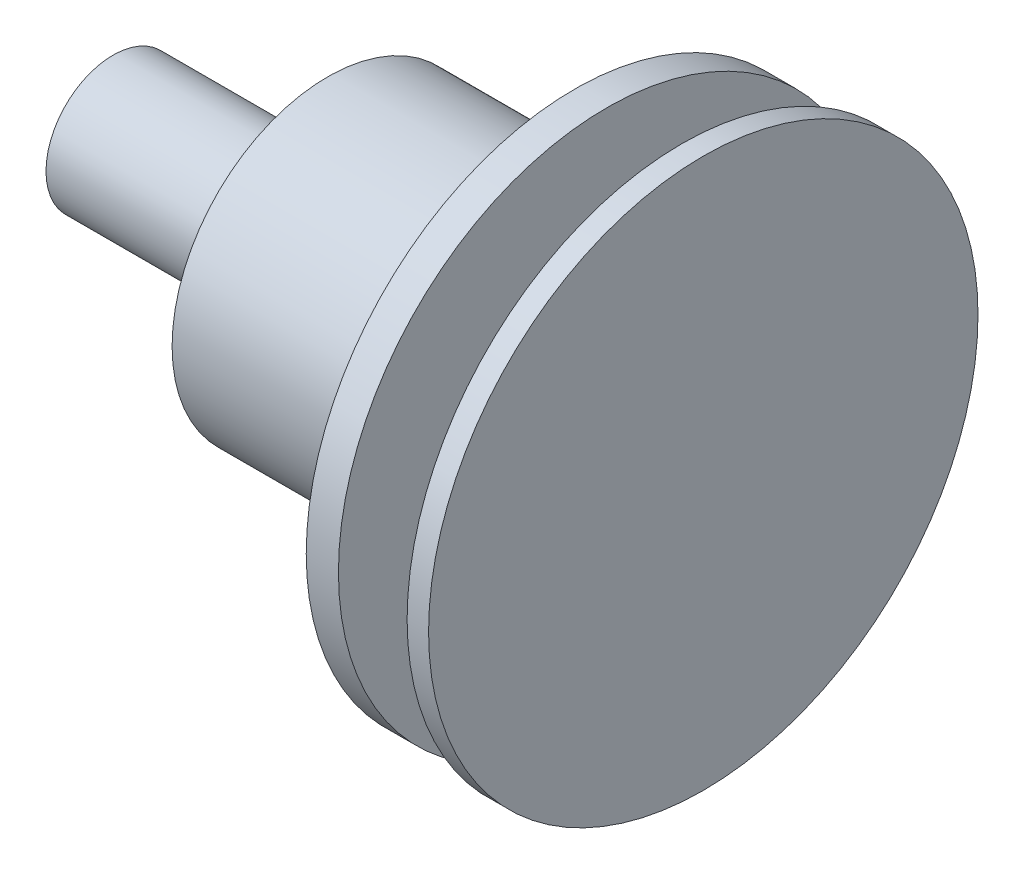
from build123d import *


with BuildPart() as part:
    # Sketch1 → Revolve7 (revolve)
    with BuildSketch(Plane.XY, mode=Mode.PRIVATE) as revolve7_sk:
        Polygon((0, 0), (0, 7.9375), (25.4, 7.9375), (25.4, 18.415), (54.61, 18.415), (54.61, 31.75), (58.42, 31.75), (58.42, 19.05), (67.31, 19.05), (67.31, 32.512), (69.85, 32.512), (69.85, 0), align=None)
    revolve(revolve7_sk.sketch.rotate(Axis((0, 0, 0), (1, 0, 0)), 90), axis=Axis((0, 0, 0), (1, 0, 0)))


solid = part.part
